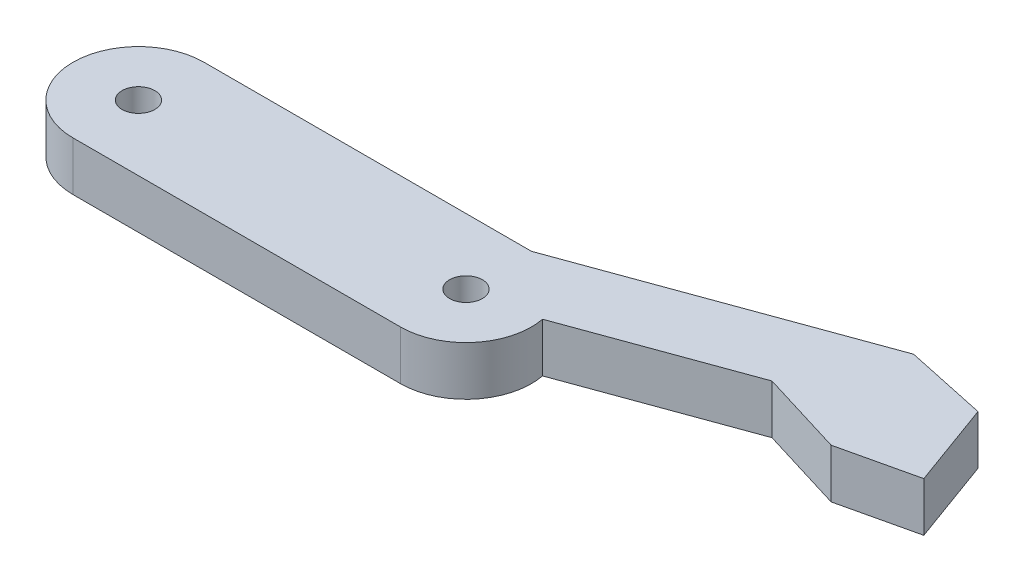
from build123d import *

# Parameters (mm, degrees)
BOSS_EXTRUDE1_DEPTH   = 15
F_1_0MM_DOWEL_HOLE1_D = 10
ESCALA1_SCALE         = 0.2


with BuildPart() as part:
    # Sketch1 → Boss-Extrude1 (new body)
    with BuildSketch(Plane(origin=(0, 0, 0), x_dir=(1, 0, 0), z_dir=(0, 1, 0))):
        with BuildLine():
            Line((0, 20), (-100, 20))
            ThreePointArc((-100, 20), (-120, 0), (-100, -20))
            Line((-100, -20), (0, -20))
            ThreePointArc((0, -20), (20, 0), (0, 20))
        make_face()
        with BuildLine():
            ThreePointArc((0, 20), (12.75180627, 15.407512352), (19.64736126, 3.739143686))
            Line((19.64736126, 3.739143686), (71, 22.429975638))
            Line((71, 22.429975638), (97, 14.480977921))
            Line((97, 14.480977921), (120, 19.790946316))
            Line((120, 19.790946316), (110.536773909, 45.790946316))
            Line((110.536773909, 45.790946316), (85.536773909, 51.132839638))
            Line((85.536773909, 51.132839638), (0, 20))
        make_face()
    extrude(amount=BOSS_EXTRUDE1_DEPTH)

    # Ø1.0mm Dowel Hole1 (through all)
    with Locations(Plane(origin=(0, 15, 0), x_dir=(1, 0, 0), z_dir=(0, 1, 0))):
        with Locations((-100, 0), (0, 0)):
            Hole(F_1_0MM_DOWEL_HOLE1_D / 2)


with BuildPart() as part_1:
    # Escala1: scaled about (-9.209886657, 7.5, -9.81321392)
    add(part.part.scale(ESCALA1_SCALE).moved(Location((-7.367909326, 6, -7.850571136))))


solid = part_1.part
